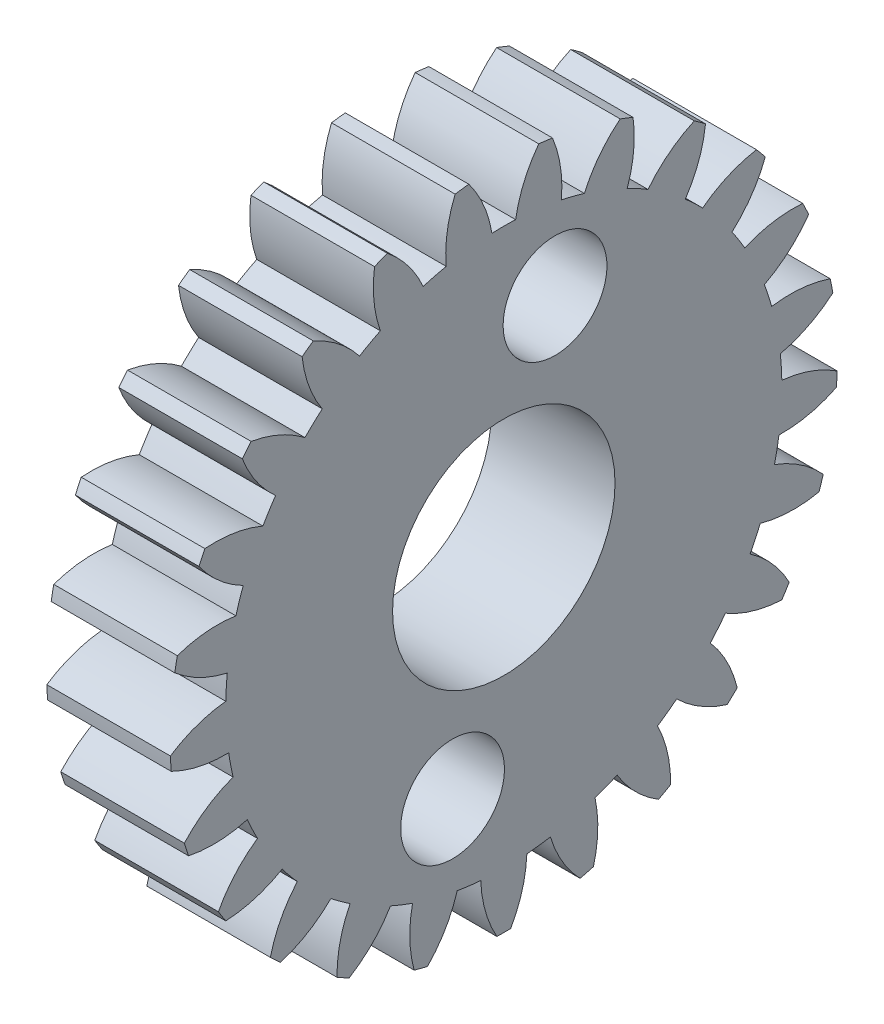
from build123d import *

# Parameters (mm, degrees)
BASPROSKE_W                  = 5
BASPROSKE_H                  = 13.5
TOOTHCUT_DEPTH               = 20.735754356
TEETHCUTS_COUNT              = 25
TEETHCUTS_ANGLE              = 345.6
BORSKE_R                     = 4.5
BORE_DEPTH                   = 50.0000508
ESQUISSE3_R                  = 2.1
ENL_V_MAT_EXTRU_1_DEPTH      = 20.727564352
R_P_TITION_CIRCULAIRE1_COUNT = 2


with BuildPart() as part:
    # BasProSke → Base-Revolve (revolve)
    with BuildSketch(Plane(origin=(0, 0, 0), x_dir=(1, 0, 0), z_dir=(0, 1, 0)), mode=Mode.PRIVATE) as base_revolve_sk:
        with Locations((2.5, 6.75)):
            Rectangle(BASPROSKE_W, BASPROSKE_H)
    revolve(base_revolve_sk.sketch.rotate(Axis((-10, 0, 0), (1, 0, 0)), 180), axis=Axis((-10, 0, 0), (1, 0, 0)))

    # TooCutSke → ToothCut (cut, through all)
    with BuildSketch(Plane(origin=(0, 0, 0), x_dir=(0, 0, -1), z_dir=(1, 0, 0))):
        with BuildLine():
            ThreePointArc((0.480087995, 11.238750665), (0, 11.249), (-0.480087995, 11.238750665))
            ThreePointArc((-0.480087995, 11.238750665), (-0.821124963, 12.40220054), (-1.432168974, 13.449361962))
            ThreePointArc((-1.432168974, 13.449361962), (0, 13.5254), (1.432168974, 13.449361962))
            ThreePointArc((1.432168974, 13.449361962), (0.821124963, 12.40220054), (0.480087995, 11.238750665))
        make_face()
    toothcut = extrude(amount=TOOTHCUT_DEPTH, mode=Mode.SUBTRACT)

    # TeethCuts: ToothCut ×25 about axis
    teethcuts_axis = Axis((-10, 0, 0), (1, 0, 0))
    for i in range(1, TEETHCUTS_COUNT):
        add(toothcut.rotate(teethcuts_axis, i * TEETHCUTS_ANGLE / (TEETHCUTS_COUNT - 1)), mode=Mode.SUBTRACT)

    # BorSke → Bore (cut, symmetric)
    with BuildSketch(Plane(origin=(0, 0, 0), x_dir=(0, 0, -1), z_dir=(1, 0, 0))):
        with Locations(Location((0, 0, 0), (0, 0, 180))):
            Circle(BORSKE_R)
    extrude(amount=BORE_DEPTH, both=True, mode=Mode.SUBTRACT)

    # Esquisse3 → Enlèv. mat.-Extru.1 (cut, through all)
    with BuildSketch(Plane.ZY):
        with Locations((-2.072553705, 7.78)):
            Circle(ESQUISSE3_R)
    enl_v_mat_extru_1 = extrude(amount=-ENL_V_MAT_EXTRU_1_DEPTH, mode=Mode.SUBTRACT)

    # Répétition circulaire1: Enlèv. mat.-Extru.1 ×2 about axis
    r_p_tition_circulaire1_axis = Axis((0, 0, 0), (1, 0, 0))
    for i in range(1, R_P_TITION_CIRCULAIRE1_COUNT):
        add(enl_v_mat_extru_1.rotate(r_p_tition_circulaire1_axis, i * 360 / R_P_TITION_CIRCULAIRE1_COUNT), mode=Mode.SUBTRACT)


solid = part.part
